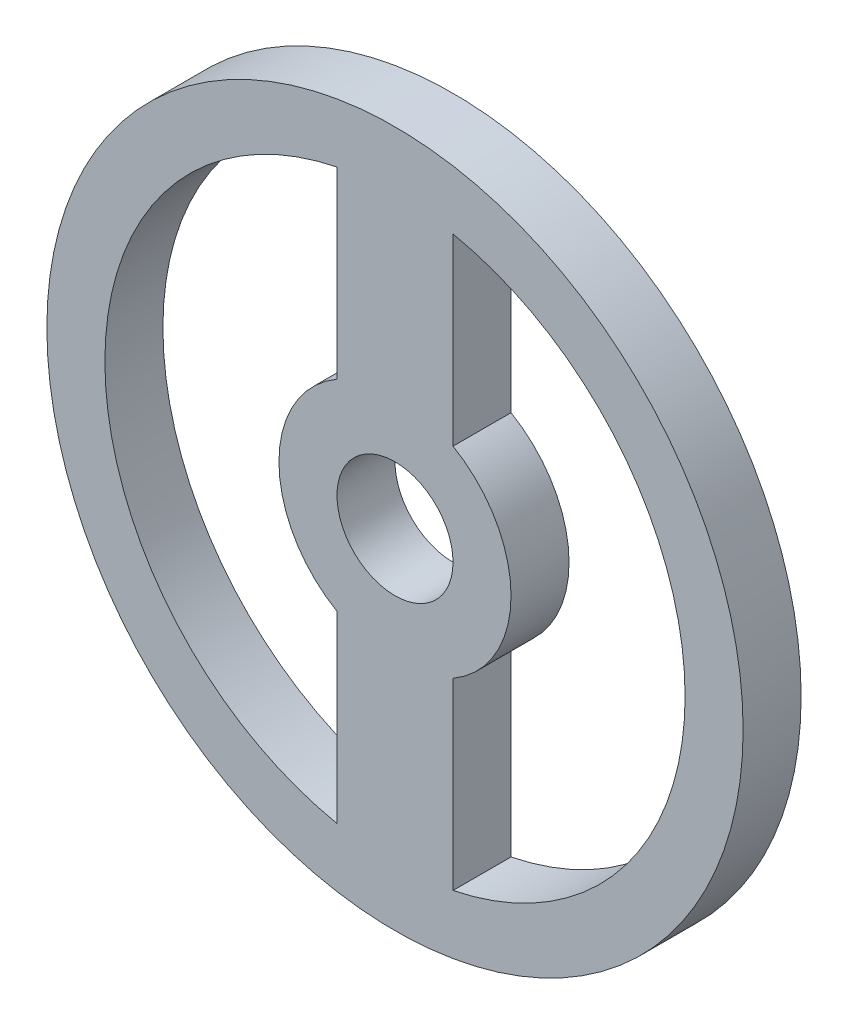
from build123d import *

# Parameters (mm, degrees)
SKETCH1_R           = 30
SKETCH1_R_2         = 5
BOSS_EXTRUDE1_DEPTH = 5


with BuildPart() as part:
    # Sketch1 → Boss-Extrude1 (new body)
    with BuildSketch(Plane.XY):
        Circle(SKETCH1_R)
        Circle(SKETCH1_R_2, mode=Mode.SUBTRACT)
        with BuildLine():
            Line((-5, 24.494897428), (-5, 8.660254038))
            ThreePointArc((-5, 8.660254038), (-10, 0), (-5, -8.660254038))
            Line((-5, -8.660254038), (-5, -24.494897428))
            ThreePointArc((-5, -24.494897428), (-25, 0), (-5, 24.494897428))
        make_face(mode=Mode.SUBTRACT)
        with BuildLine():
            Line((5, 24.494897428), (5, 8.660254038))
            ThreePointArc((5, 8.660254038), (10, 0), (5, -8.660254038))
            Line((5, -8.660254038), (5, -24.494897428))
            ThreePointArc((5, -24.494897428), (25, 0), (5, 24.494897428))
        make_face(mode=Mode.SUBTRACT)
    extrude(amount=BOSS_EXTRUDE1_DEPTH)


solid = part.part
